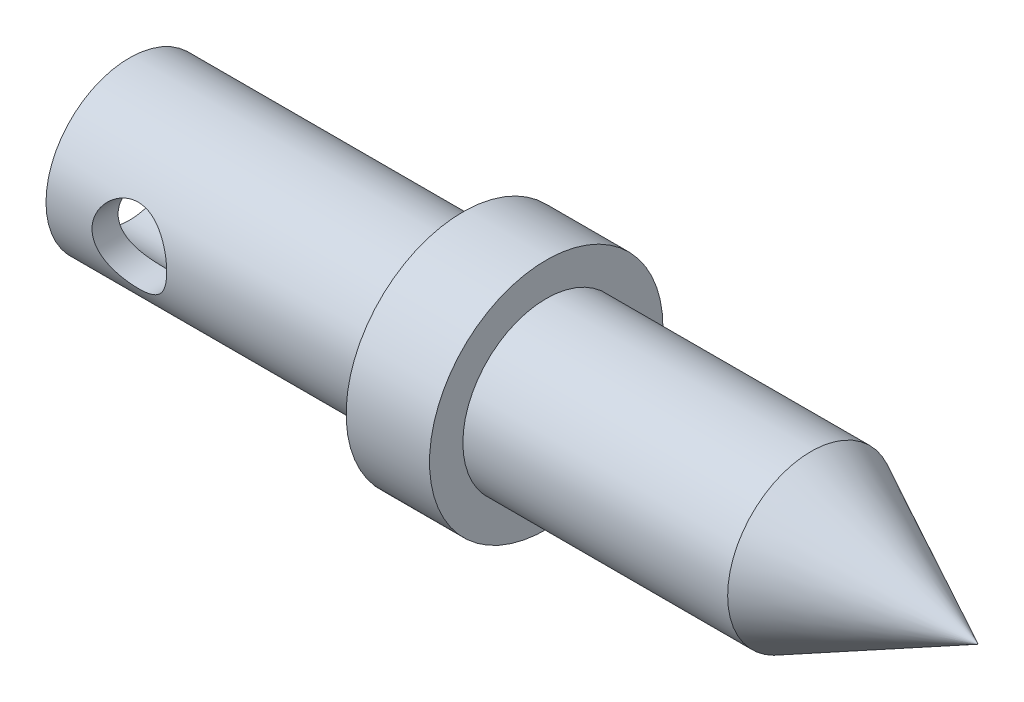
from build123d import *

# Parameters (mm, degrees)
SKETCH1_R                      = 4.445
BOSS_EXTRUDE1_DEPTH            = 3.175
SKETCH2_R                      = 3.175
BOSS_EXTRUDE2_DEPTH            = 16.4338
BOSS_EXTRUDE3_START            = 12.7
SKETCH3_R                      = 3.175
BOSS_EXTRUDE3_DEPTH            = 12.7
CHAMFER1_SIZE                  = 6.35
CHAMFER1_SIZE2                 = 3.165993211
SKETCH4_R                      = 2.1828125
CUT_EXTRUDE1_DEPTH             = 6.35
SKETCH5_R                      = 1.7859375
CUT_EXTRUDE2_DEPTH             = 1.905
CUT_EXTRUDE5_REACH             = 22.592
CUT_EXTRUDE5_END_RADIUS        = 3.175
SKETCH7_R                      = 1.4224
CUT_EXTRUDE5_DIRECTION_2_DEPTH = 21.591772324


with BuildPart() as part:
    # Sketch1 → Boss-Extrude1 (new body)
    with BuildSketch(Plane(origin=(0, 0, 0), x_dir=(0, 0, -1), z_dir=(1, 0, 0))):
        Circle(SKETCH1_R)
    extrude(amount=BOSS_EXTRUDE1_DEPTH)

    # Sketch2 → Boss-Extrude2 (add)
    with BuildSketch(Plane(origin=(3.175, 0, 0), x_dir=(0, 0, -1), z_dir=(1, 0, 0))):
        Circle(SKETCH2_R)
    extrude(amount=BOSS_EXTRUDE2_DEPTH)

    # Sketch3 → Boss-Extrude3 (add)
    with BuildSketch(Plane.ZY.offset(BOSS_EXTRUDE3_START)):
        Circle(SKETCH3_R)
    extrude(amount=-BOSS_EXTRUDE3_DEPTH)

    # Chamfer1
    chamfer1_edges = [part.edges().sort_by_distance(p)[0] for p in [
        (19.6088, 0, 3.175),
    ]]
    chamfer1_side = [part.faces().sort_by_distance(p)[0] for p in [
        (11.3919, 0, 3.175),
    ]]
    chamfer(chamfer1_edges, length=CHAMFER1_SIZE, length2=CHAMFER1_SIZE2, reference=chamfer1_side[0])

    # Sketch4 → Cut-Extrude1 (cut)
    with BuildSketch(Plane.ZY.offset(12.7)):
        Circle(SKETCH4_R)
    extrude(amount=-CUT_EXTRUDE1_DEPTH, mode=Mode.SUBTRACT)

    # Sketch5 → Cut-Extrude2 (cut)
    with BuildSketch(Plane.ZY.offset(6.35)):
        Circle(SKETCH5_R)
    extrude(amount=-CUT_EXTRUDE2_DEPTH, mode=Mode.SUBTRACT)

    # Cut-Extrude5: up to this cylinder (the profile starts inside it)
    cut_extrude5_end = Plane(origin=(-9.525, 0, 0), z_dir=(1, 0, 0)) * Cylinder(CUT_EXTRUDE5_END_RADIUS, 52.534, mode=Mode.PRIVATE)
    # Sketch7 → Cut-Extrude5 (cut, up to the surface)
    with BuildSketch(Plane.XY, mode=Mode.PRIVATE) as cut_extrude5_sk1:
        with Locations((-9.525, 0)):
            Circle(SKETCH7_R)
    cut_extrude5_tool1 = extrude(cut_extrude5_sk1.sketch, amount=CUT_EXTRUDE5_REACH, mode=Mode.PRIVATE) & cut_extrude5_end
    add(cut_extrude5_tool1.solids().sort_by_distance((-9.525, 0, 0))[0], mode=Mode.SUBTRACT)

    # Sketch7 → Cut-Extrude5 direction 2 (cut)
    with BuildSketch(Plane.XY):
        with Locations((-9.525, 0)):
            Circle(SKETCH7_R)
    extrude(amount=-CUT_EXTRUDE5_DIRECTION_2_DEPTH, mode=Mode.SUBTRACT)


solid = part.part
